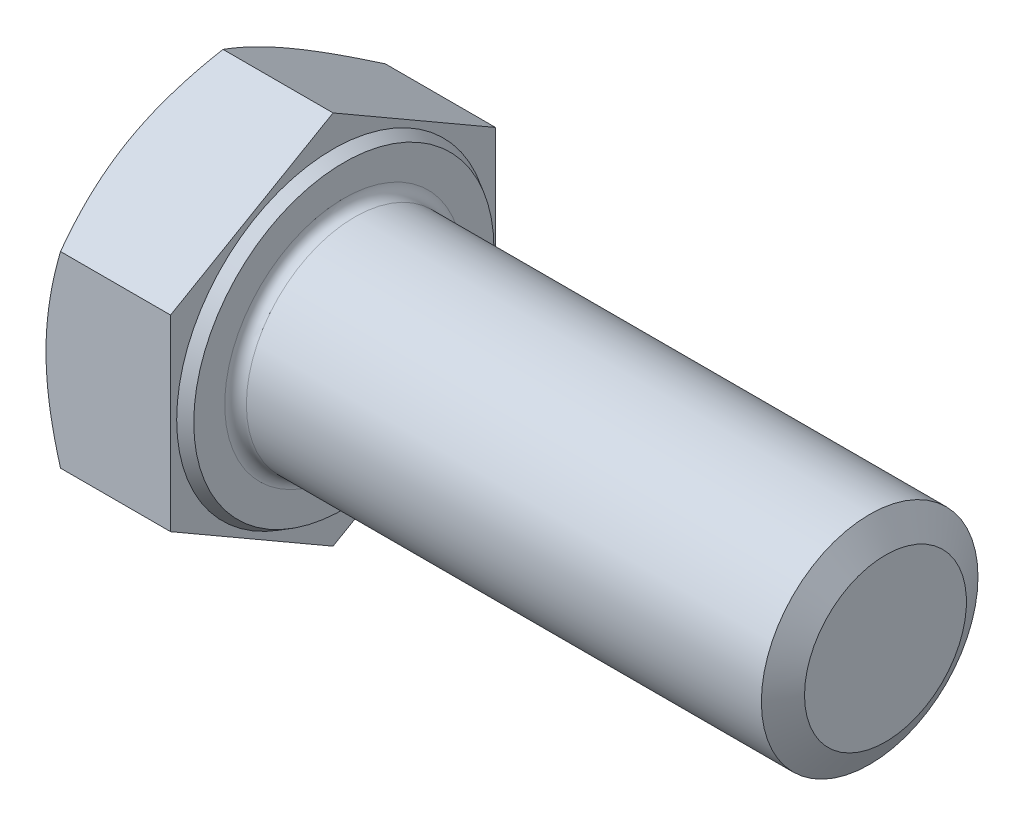
from build123d import *

# Parameters (mm, degrees)
EXTRUDE_396_DEPTH = 7.5
FILLET_1266_R     = 0.6


with BuildPart() as part:
    # 草图1 → Extrude 396 (new body)
    with BuildSketch(Plane(origin=(0, 0, 0), x_dir=(0, 0, -1), z_dir=(1, 0, 0))):
        Polygon((9, 5.196152423), (9, -5.196152423), (0, -10.392304845), (-9, -5.196152423), (-9, 5.196152423), (0, 10.392304845), align=None)
    extrude(amount=EXTRUDE_396_DEPTH)

    # 草图2 → 凸台-旋转1 (revolve)
    with BuildSketch(Plane.XY, mode=Mode.PRIVATE) as revolve_1_sk:
        Polygon((0, 0), (37.5, 0), (37.5, 4.4845), (37.5, 6), (0, 6), align=None)
    revolve(revolve_1_sk.sketch.rotate(Axis((0, 0, 0), (1, 0, 0)), 90), axis=Axis((0, 0, 0), (1, 0, 0)))

    # 草图3 → 切除-旋转1 (revolve, cut)
    with BuildSketch(Plane.XY):
        Polygon((0, 9), (3.690598923, 15.392304845), (3.690598923, 20.392304845), (-10, 20.392304845), (-10, 9), align=None)
    revolve(axis=Axis((0, 0, 0), (1, 0, 0)), mode=Mode.SUBTRACT)

    # 草图4 → 切除-旋转3 (revolve, cut)
    with BuildSketch(Plane.XY, mode=Mode.PRIVATE) as cut_revolve_3_sk:
        Polygon((7.5, 8.315), (6.9, 8.661410162), (6.9, 10.392304845), (7.5, 10.392304845), align=None)
    revolve(cut_revolve_3_sk.sketch.rotate(Axis((0, 0, 0), (1, 0, 0)), 90), axis=Axis((0, 0, 0), (1, 0, 0)), mode=Mode.SUBTRACT)

    # Fillet 1266
    fillet_1266_edges = [part.edges().sort_by_distance(p)[0] for p in [
        (7.5, 0, -6),
    ]]
    fillet(fillet_1266_edges, radius=FILLET_1266_R)

    # 草图6 → 切除-旋转4 (revolve, cut)
    with BuildSketch(Plane.XY, mode=Mode.PRIVATE) as cut_revolve_4_sk:
        Polygon((36.625, 6), (38.375, 6), (37.5, 4.484455543), align=None)
    revolve(cut_revolve_4_sk.sketch.rotate(Axis((0, 0, 0), (1, 0, 0)), 90), axis=Axis((0, 0, 0), (1, 0, 0)), mode=Mode.SUBTRACT)


solid = part.part
